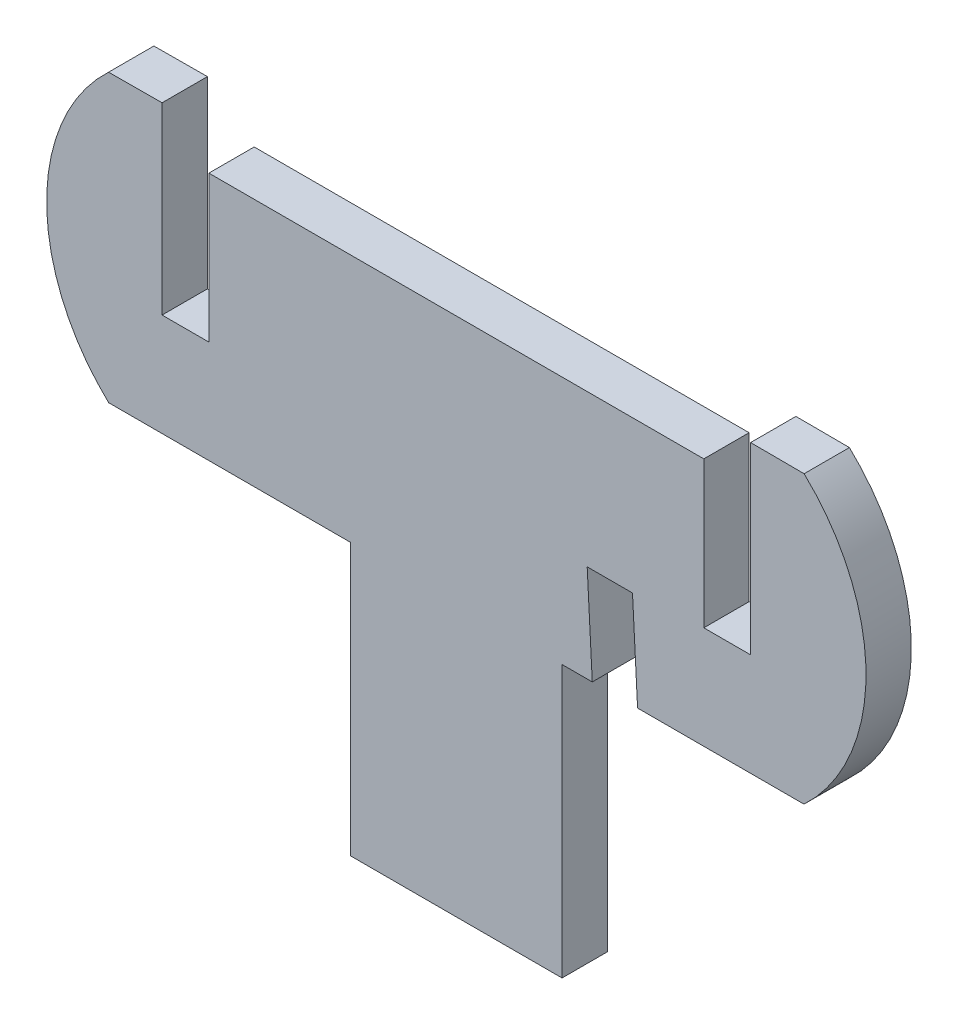
from build123d import *

# Parameters (mm, degrees)
BASE_EXTRUDE_DEPTH = 3


with BuildPart() as part:
    # Sketch1 → Base-Extrude (new body)
    with BuildSketch(Plane.XY):
        with BuildLine():
            Line((457.287518249, -79.214649933), (453.745445311, -79.230530857))
            ThreePointArc((453.745445311, -79.230530857), (449.646042877, -88.708611573), (453.753998991, -98.182988118))
            Line((453.753998991, -98.182988118), (469.771556658, -98.182988118))
            Line((469.771556658, -98.182988118), (469.765330169, -116.15983969))
            Line((469.765330169, -116.15983969), (483.771556658, -116.15983969))
            Line((483.771556658, -116.15983969), (483.771556658, -98.182988118))
            Line((483.771556658, -98.182988118), (485.771556658, -98.182988118))
            Line((485.771556658, -98.182988118), (485.434474546, -91.751078274))
            Line((485.434474546, -91.751078274), (488.434474546, -91.751078274))
            Line((488.434474546, -91.751078274), (488.771556658, -98.182988118))
            Line((488.771556658, -98.182988118), (499.789114325, -98.182988118))
            ThreePointArc((499.789114325, -98.182988118), (503.897070438, -88.708611573), (499.797668004, -79.230530857))
            Line((499.797668004, -79.230530857), (496.255595066, -79.214649933))
            Line((496.255595066, -79.214649933), (496.255595066, -91.387236838))
            Line((496.255595066, -91.387236838), (493.156556658, -91.387236838))
            Line((493.156556658, -91.387236838), (493.156556658, -81.698972351))
            Line((493.156556658, -81.698972351), (460.386556658, -81.698972351))
            Line((460.386556658, -81.698972351), (460.386556658, -91.387236838))
            Line((460.386556658, -91.387236838), (457.287518249, -91.387236838))
            Line((457.287518249, -91.387236838), (457.287518249, -79.214649933))
        make_face()
    extrude(amount=BASE_EXTRUDE_DEPTH)


solid = part.part
